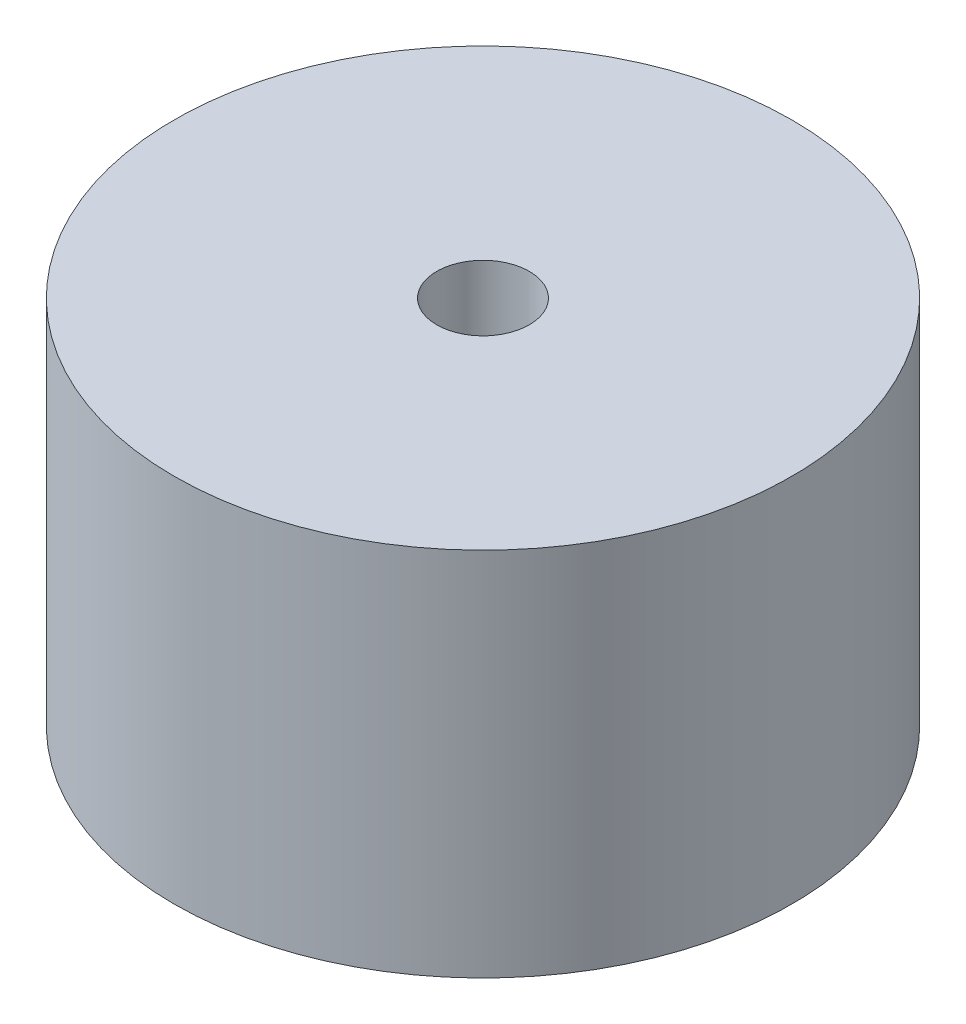
from build123d import *

# Parameters (mm, degrees)
SKETCH1_R           = 10
SKETCH1_R_2         = 1.5
BOSS_EXTRUDE1_DEPTH = 12


with BuildPart() as part:
    # Sketch1 → Boss-Extrude1 (new body)
    with BuildSketch(Plane(origin=(0, 0, 0), x_dir=(1, 0, 0), z_dir=(0, 1, 0))):
        with Locations(Location((0, 0, 0), (0, 0, 270))):
            Circle(SKETCH1_R)
        with Locations(Location((0, 0, 0), (0, 0, 270))):
            Circle(SKETCH1_R_2, mode=Mode.SUBTRACT)
    extrude(amount=BOSS_EXTRUDE1_DEPTH)


solid = part.part
